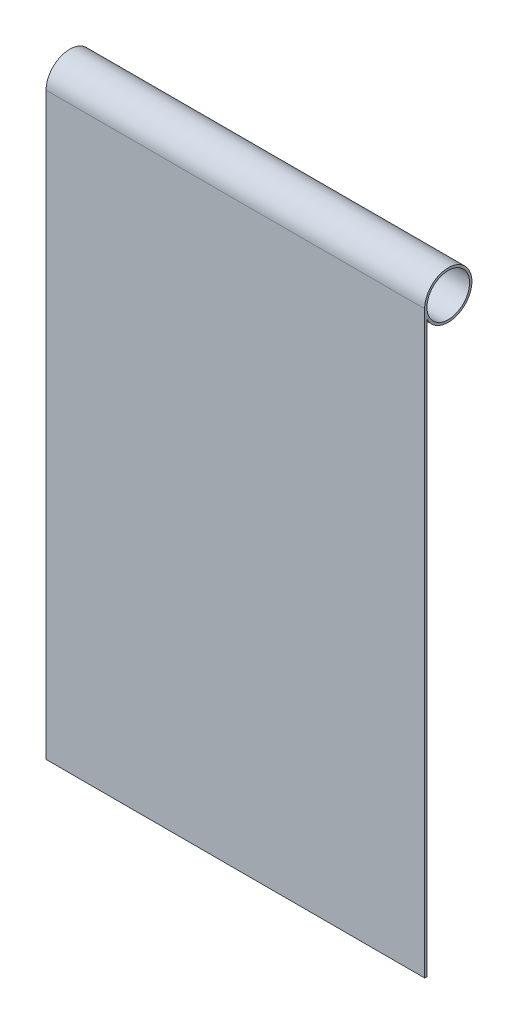
from build123d import *

# Parameters (mm, degrees)
BOSS_EXTRUDE1_DEPTH      = 80
BOSS_EXTRUDE1_DEPTH_BACK = 80
SKETCH1_R                = 9


with BuildPart() as part:
    # Sketch1 → Boss-Extrude1 (new, two sides: drawn at the far end of the back side and taken through both)
    with BuildSketch(Plane(origin=(0, 0, 0), x_dir=(0, 0, -1), z_dir=(1, 0, 0)).offset(-BOSS_EXTRUDE1_DEPTH_BACK)):
        with BuildLine():
            Line((-10, 125), (-10, -120))
            Line((-10, -120), (-9, -120))
            Line((-9, -120), (-9, 120.641101056))
            ThreePointArc((-9, 120.641101056), (9.746794345, 127.236067977), (-10, 125))
        make_face()
        with Locations((0, 125)):
            Circle(SKETCH1_R, mode=Mode.SUBTRACT)
    extrude(amount=BOSS_EXTRUDE1_DEPTH + BOSS_EXTRUDE1_DEPTH_BACK)


solid = part.part
